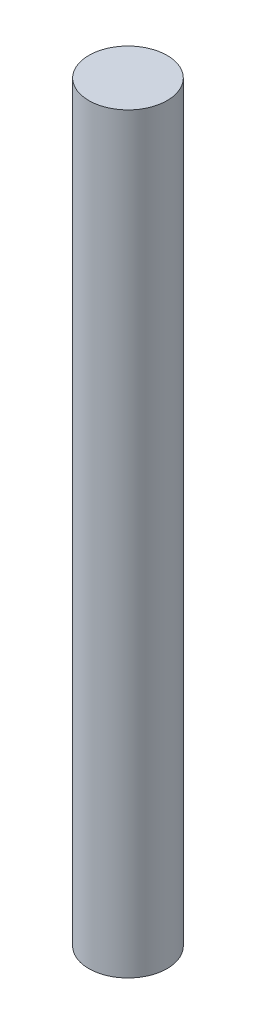
from build123d import *

# Parameters (mm, degrees)
SKETCH1_R           = 0.625
BOSS_EXTRUDE1_DEPTH = 12


with BuildPart() as part:
    # Sketch1 → Boss-Extrude1 (new body)
    with BuildSketch(Plane(origin=(0, 0, 0), x_dir=(1, 0, 0), z_dir=(0, 1, 0))):
        with Locations(Location((0, 0, 0), (0, 0, 270))):
            Circle(SKETCH1_R)
    extrude(amount=BOSS_EXTRUDE1_DEPTH)


solid = part.part
